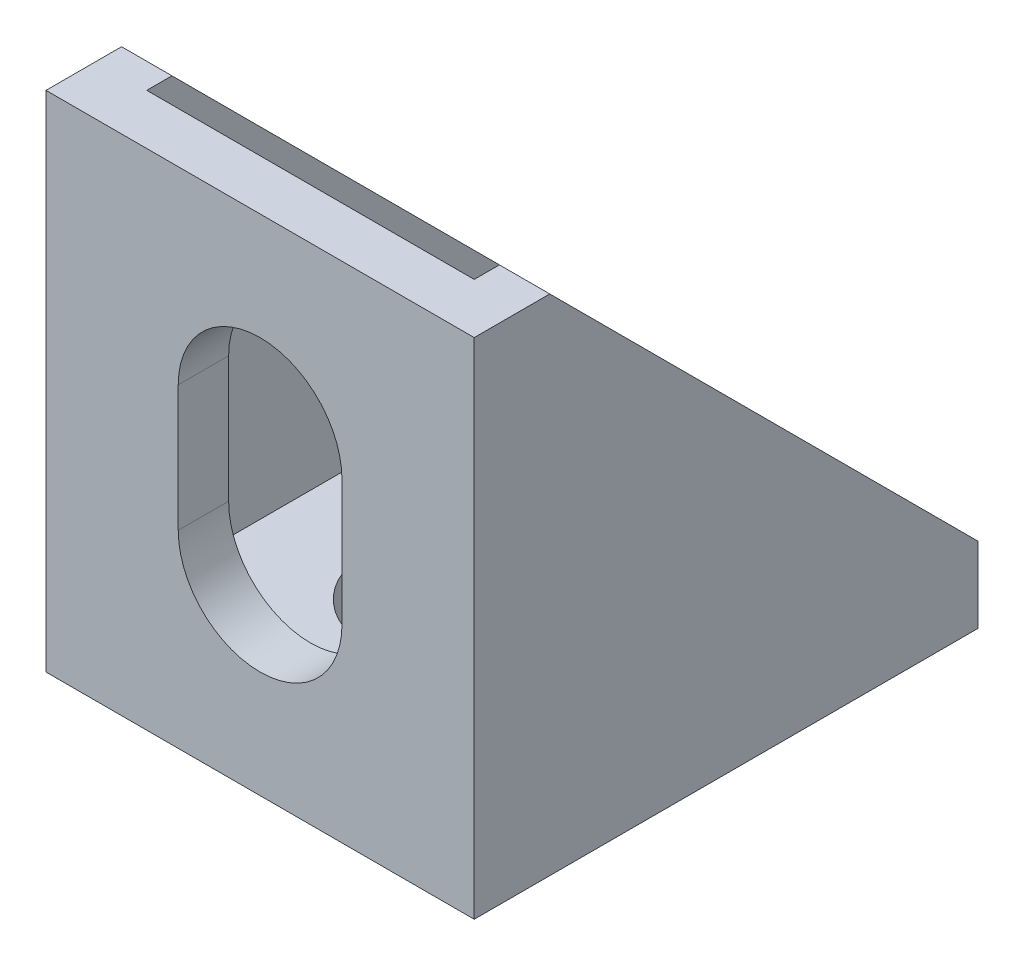
from build123d import *

# Parameters (mm, degrees)
BODY_DEPTH     = 8.5
SKETCH2_W      = 13
SKETCH2_H      = 17
EXTUSION_DEPTH = 18
HOLE_A_DEPTH   = 29.217902119
HOLE_B_DEPTH   = 17


with BuildPart() as part:
    # Sketch1 → Body (new, symmetric)
    with BuildSketch(Plane(origin=(0, 0, 0), x_dir=(0, 0, -1), z_dir=(1, 0, 0))):
        Polygon((3, 20), (0, 20), (0, 0), (20, 0), (20, 3), align=None)
    extrude(amount=BODY_DEPTH, both=True)

    # Sketch2 → Extusion (cut)
    with BuildSketch(Plane(origin=(0, 0, -20), x_dir=(-1, 0, 0), z_dir=(0, 0, -1))):
        with Locations((0, 11.5)):
            Rectangle(SKETCH2_W, SKETCH2_H)
    extrude(amount=-EXTUSION_DEPTH, mode=Mode.SUBTRACT)

    # Sketch3 → Hole_A (cut, through all)
    with BuildSketch(Plane(origin=(0, 0, -2), x_dir=(-1, 0, 0), z_dir=(0, 0, -1))):
        with BuildLine():
            Line((-3.25, 7.5), (-3.25, 12.5))
            ThreePointArc((-3.25, 12.5), (0, 15.75), (3.25, 12.5))
            Line((3.25, 12.5), (3.25, 7.5))
            ThreePointArc((3.25, 7.5), (0, 4.25), (-3.25, 7.5))
        make_face()
    extrude(amount=-HOLE_A_DEPTH, mode=Mode.SUBTRACT)

    # Sketch4 → Hole_B (cut)
    with BuildSketch(Plane(origin=(0, 3, 0), x_dir=(1, 0, 0), z_dir=(0, 1, 0))):
        with BuildLine():
            Line((-3.25, 7.5), (-3.25, 12.5))
            ThreePointArc((-3.25, 12.5), (0, 15.75), (3.25, 12.5))
            Line((3.25, 12.5), (3.25, 7.5))
            ThreePointArc((3.25, 7.5), (0, 4.25), (-3.25, 7.5))
        make_face()
    extrude(amount=-HOLE_B_DEPTH, mode=Mode.SUBTRACT)


solid = part.part
